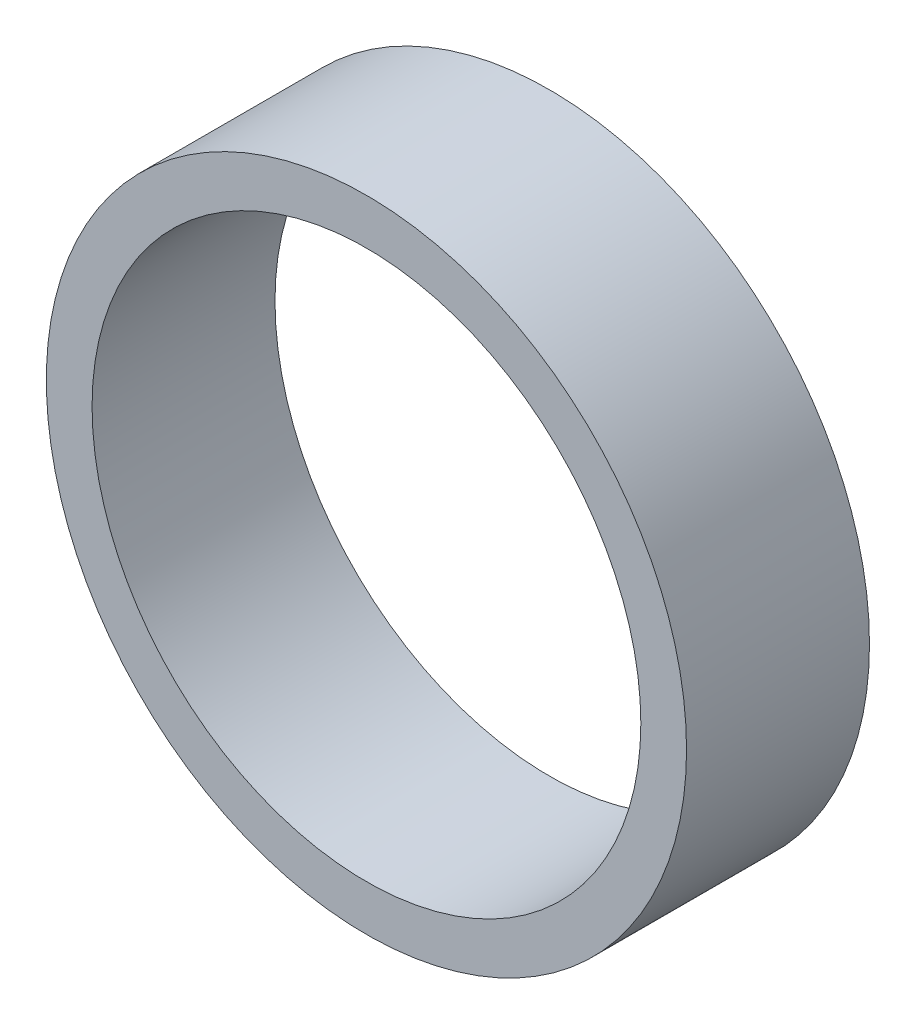
from build123d import *

# Parameters (mm, degrees)
SKETCH1_W = 2.5
SKETCH1_H = 10


with BuildPart() as part:
    # Sketch1 → REV_Cone_Spacer_30x35x10 (revolve)
    with BuildSketch(Plane(origin=(0, 0, 0), x_dir=(1, 0, 0), z_dir=(0, 1, 0))):
        with Locations((16.25, 66)):
            Rectangle(SKETCH1_W, SKETCH1_H)
    revolve(axis=Axis((0, 0, 150), (0, 0, -1)))


solid = part.part
